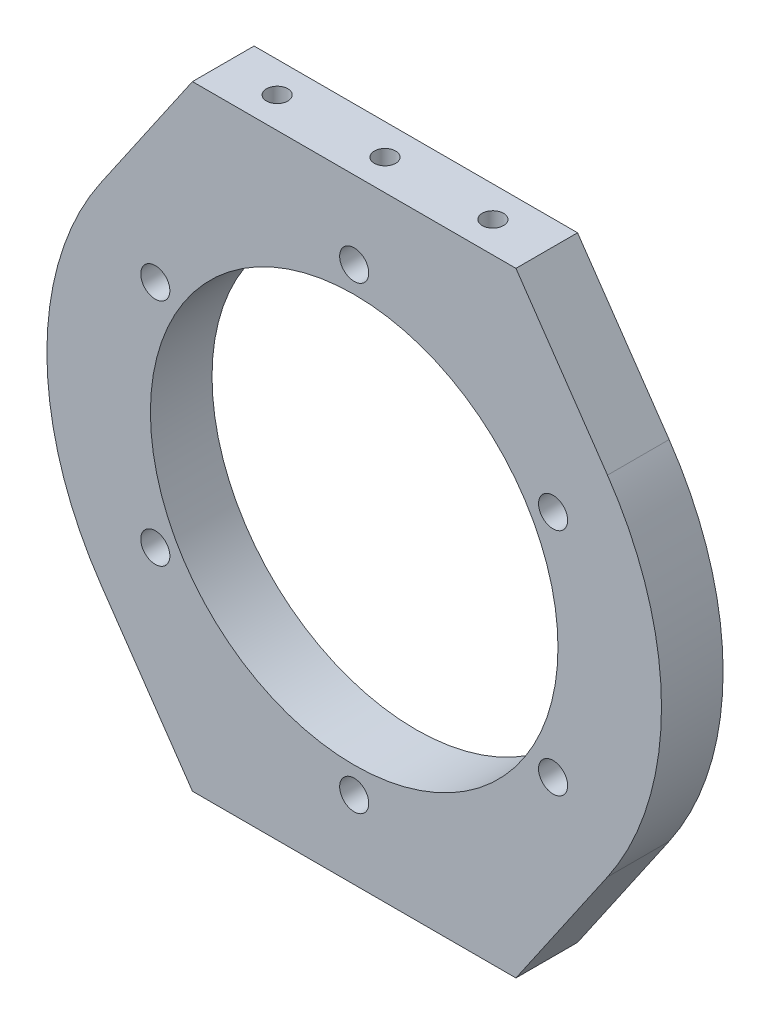
from build123d import *

# Parameters (mm, degrees)
BOSS_EXTRUDE1_DEPTH       = 9.525
M4_CLEARANCE_HOLE1_D      = 4.5
SKETCH4_R                 = 31.5
CUT_EXTRUDE1_DEPTH        = 68.847075287
M4X0_7_TAPPED_HOLE1_D     = 3.3
M4X0_7_TAPPED_HOLE1_DEPTH = 10
M4X0_7_TAPPED_HOLE1_TIP   = 0.991420021
M4X0_7_TAPPED_HOLE2_D     = 3.3
M4X0_7_TAPPED_HOLE2_DEPTH = 10
M4X0_7_TAPPED_HOLE2_TIP   = 0.991420021


with BuildPart() as part:
    # Sketch1 → Boss-Extrude1 (new body)
    with BuildSketch(Plane.XY):
        with BuildLine():
            Line((-25, 47.5), (25, 47.5))
            Line((25, 47.5), (39.154013015, 26.892624729))
            ThreePointArc((39.154013015, 26.892624729), (47.5, 0), (39.154013015, -26.892624729))
            Line((39.154013015, -26.892624729), (25, -47.5))
            Line((25, -47.5), (-25, -47.5))
            Line((-25, -47.5), (-39.154013015, -26.892624729))
            ThreePointArc((-39.154013015, -26.892624729), (-47.5, 0), (-39.154013015, 26.892624729))
            Line((-39.154013015, 26.892624729), (-25, 47.5))
        make_face()
    extrude(amount=-BOSS_EXTRUDE1_DEPTH)

    # M4 Clearance Hole1 (through all)
    with Locations(Plane.XY):
        with Locations((-30.743901834, 17.75), (0, 35.5), (59.233049824, 29.038488654), (30.743901834, 17.75), (30.743901834, -17.75), (0, -35.5), (-30.743901834, -17.75)):
            Hole(M4_CLEARANCE_HOLE1_D / 2)

    # Sketch4 → Cut-Extrude1 (cut, through all)
    with BuildSketch(Plane(origin=(0, 0, -9.525), x_dir=(-1, 0, 0), z_dir=(0, 0, -1))):
        Circle(SKETCH4_R)
    extrude(amount=-CUT_EXTRUDE1_DEPTH, mode=Mode.SUBTRACT)

    # M4x0.7 Tapped Hole1
    with Locations(Plane(origin=(0, 47.5, 0), x_dir=(1, 0, 0), z_dir=(0, 1, 0))):
        with Locations((16.67, 4.7625), (0, 4.7625), (-16.67, 4.7625)):
            Hole(M4X0_7_TAPPED_HOLE1_D / 2, depth=M4X0_7_TAPPED_HOLE1_DEPTH)
            with Locations((0, 0, -(M4X0_7_TAPPED_HOLE1_DEPTH + M4X0_7_TAPPED_HOLE1_TIP / 2))):  # 118° drill point
                Cone(0, M4X0_7_TAPPED_HOLE1_D / 2, M4X0_7_TAPPED_HOLE1_TIP, mode=Mode.SUBTRACT)

    # M4x0.7 Tapped Hole2
    with Locations(Plane.XZ.offset(47.5)):
        with Locations((0, -4.7625), (16.67, -4.7625), (-16.67, -4.7625)):
            Hole(M4X0_7_TAPPED_HOLE2_D / 2, depth=M4X0_7_TAPPED_HOLE2_DEPTH)
            with Locations((0, 0, -(M4X0_7_TAPPED_HOLE2_DEPTH + M4X0_7_TAPPED_HOLE2_TIP / 2))):  # 118° drill point
                Cone(0, M4X0_7_TAPPED_HOLE2_D / 2, M4X0_7_TAPPED_HOLE2_TIP, mode=Mode.SUBTRACT)


solid = part.part
